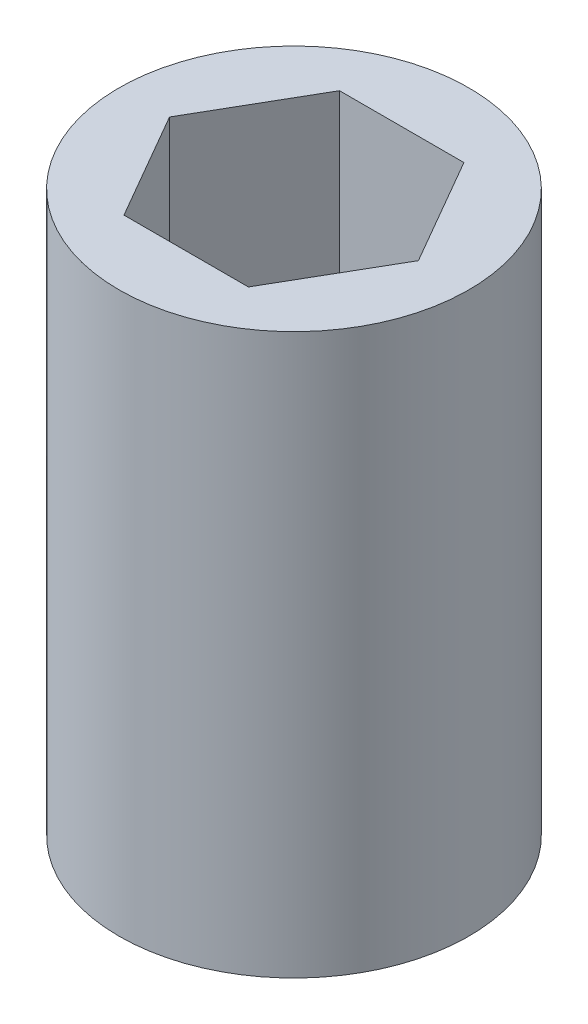
from build123d import *

# Parameters (mm, degrees)
SKETCH1_R           = 7.9375
BOSS_EXTRUDE1_DEPTH = 25.4


with BuildPart() as part:
    # Sketch1 → Boss-Extrude1 (new body)
    with BuildSketch(Plane(origin=(0, 0, 0), x_dir=(1, 0, 0), z_dir=(0, 1, 0))):
        with Locations(Location((0, 0, 0), (0, 0, 270))):
            Circle(SKETCH1_R)
        Polygon((5.645908282, 0), (2.822954141, 4.8895), (-2.822954141, 4.8895), (-5.645908282, 0), (-2.822954141, -4.8895), (2.822954141, -4.8895), align=None, mode=Mode.SUBTRACT)
    extrude(amount=BOSS_EXTRUDE1_DEPTH)


solid = part.part
